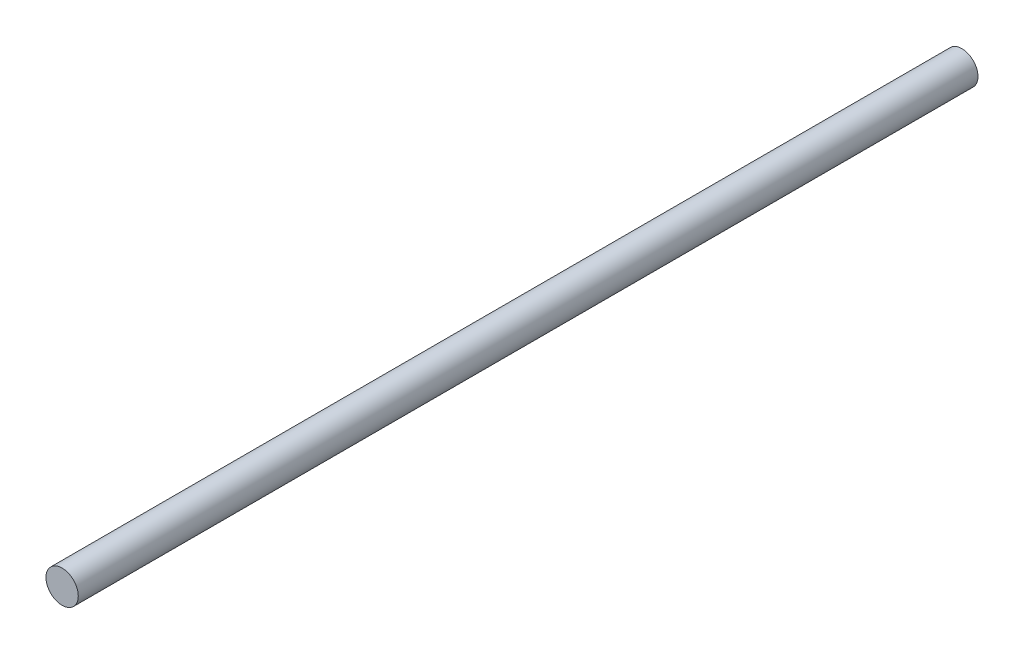
from build123d import *

# Parameters (mm, degrees)
SKETCH1_R           = 50.8
BOSS_EXTRUDE1_DEPTH = 2828.544


with BuildPart() as part:
    # Sketch1 → Boss-Extrude1 (new body)
    with BuildSketch(Plane.XY):
        Circle(SKETCH1_R)
    extrude(amount=BOSS_EXTRUDE1_DEPTH)


solid = part.part
